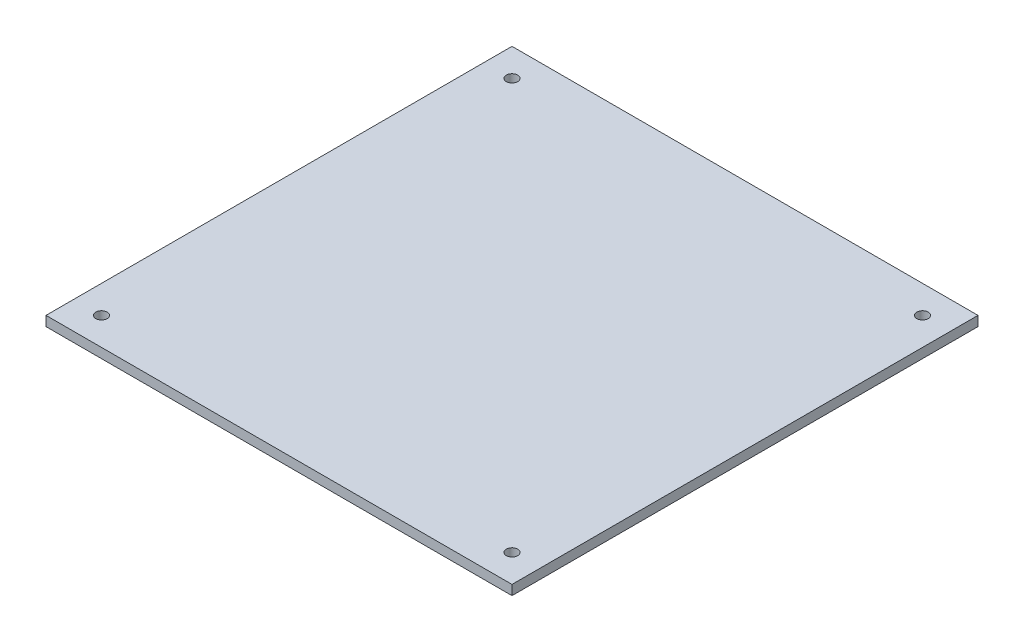
from build123d import *

# Parameters (mm, degrees)
SKETCH1_W           = 266.7
SKETCH1_H           = 266.7
SKETCH1_R           = 3.2639
BOSS_EXTRUDE1_DEPTH = 5.588


with BuildPart() as part:
    # Sketch1 → Boss-Extrude1 (new body)
    with BuildSketch(Plane(origin=(0, 0, 0), x_dir=(1, 0, 0), z_dir=(0, 1, 0))):
        with Locations((133.35, 133.35)):
            Rectangle(SKETCH1_W, SKETCH1_H)
        with Locations(Location((15.875, 250.825, 0), (0, 0, 270))):
            Circle(SKETCH1_R, mode=Mode.SUBTRACT)
        with Locations(Location((250.825, 250.825, 0), (0, 0, 270))):
            Circle(SKETCH1_R, mode=Mode.SUBTRACT)
        with Locations(Location((15.875, 15.875, 0), (0, 0, 270))):
            Circle(SKETCH1_R, mode=Mode.SUBTRACT)
        with Locations(Location((250.825, 15.875, 0), (0, 0, 270))):
            Circle(SKETCH1_R, mode=Mode.SUBTRACT)
    extrude(amount=BOSS_EXTRUDE1_DEPTH)


solid = part.part
